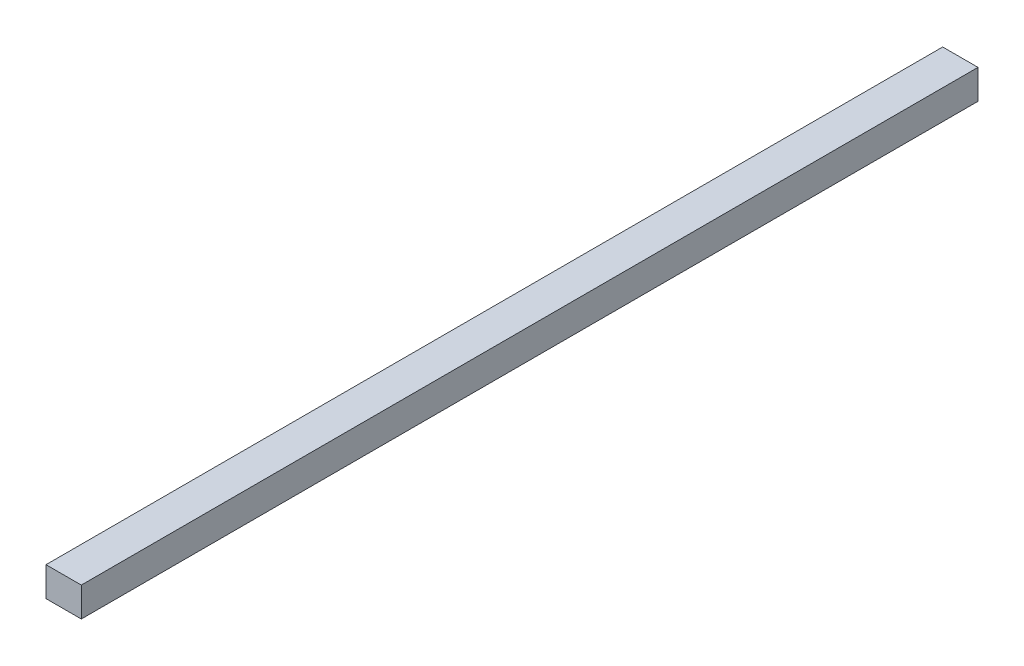
from build123d import *

# Parameters (mm, degrees)
SKETCH3_W           = 12
SKETCH3_H           = 10
BOSS_EXTRUDE1_DEPTH = 152.4


with BuildPart() as part:
    # Sketch3 → Boss-Extrude1 (new, symmetric)
    with BuildSketch(Plane.XY):
        Rectangle(SKETCH3_W, SKETCH3_H)
    extrude(amount=BOSS_EXTRUDE1_DEPTH, both=True)


solid = part.part
